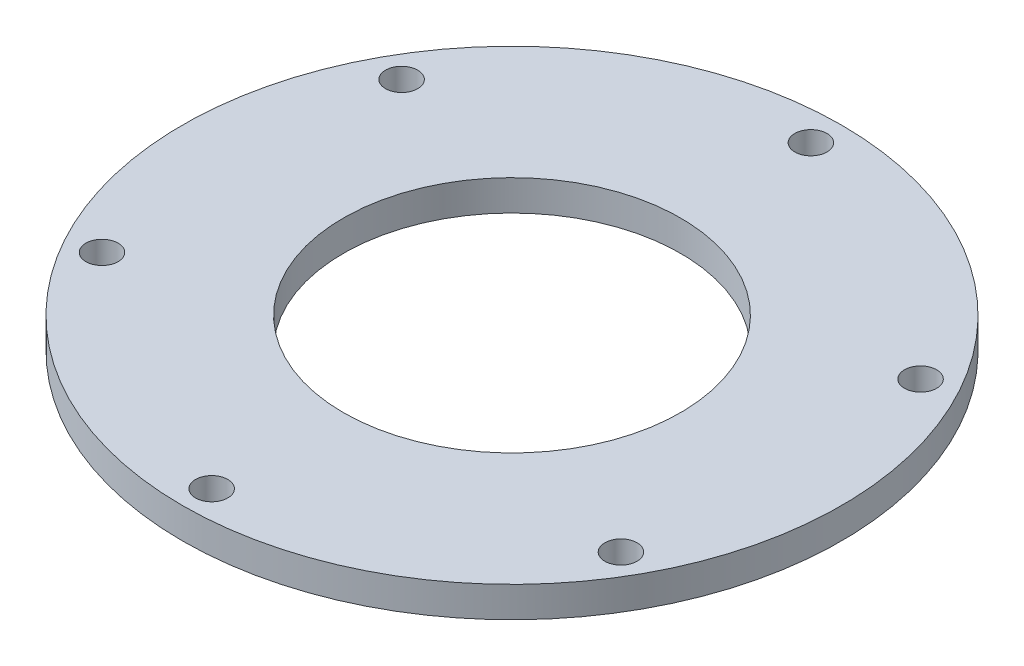
from build123d import *

# Parameters (mm, degrees)
CROQUIS1_R              = 107.5
SALIENTE_EXTRUIR1_DEPTH = 10
MATRIZC1_COUNT          = 6
CROQUIS4_R              = 55
CORTAR_EXTRUIR1_DEPTH   = 10


with BuildPart() as part:
    # Croquis1 → Saliente-Extruir1 (new body)
    with BuildSketch(Plane(origin=(0, 0, 0), x_dir=(1, 0, 0), z_dir=(0, 1, 0))):
        with Locations(Location((0, 0, 0), (0, 0, 270))):
            Circle(CROQUIS1_R)
    extrude(amount=SALIENTE_EXTRUIR1_DEPTH)

    # Croquis6 → Taladro roscado M12x1.51 (revolve, cut)
    with BuildSketch(Plane(origin=(0, 10, -97.5), x_dir=(0, 0, 1), z_dir=(1, 0, 0))):
        Polygon((0, 0), (0, 34.65451825), (5.25, 31.5), (5.25, 0), align=None)
    taladro_roscado_m12x1_51 = revolve(axis=Axis((0, 16.35, -97.5), (0, -1, 0)), mode=Mode.SUBTRACT)

    # MatrizC1: Taladro roscado M12x1.51 ×6 about axis
    matrizc1_axis = Axis((0, 0, 0.233100581), (0, 1, 0))
    for i in range(1, MATRIZC1_COUNT):
        add(taladro_roscado_m12x1_51.rotate(matrizc1_axis, i * 360 / MATRIZC1_COUNT), mode=Mode.SUBTRACT)

    # Croquis4 → Cortar-Extruir1 (cut)
    with BuildSketch(Plane(origin=(0, 10, 0), x_dir=(1, 0, 0), z_dir=(0, 1, 0))):
        with Locations(Location((0, 0, 0), (0, 0, 270))):
            Circle(CROQUIS4_R)
    extrude(amount=-CORTAR_EXTRUIR1_DEPTH, mode=Mode.SUBTRACT)


solid = part.part
